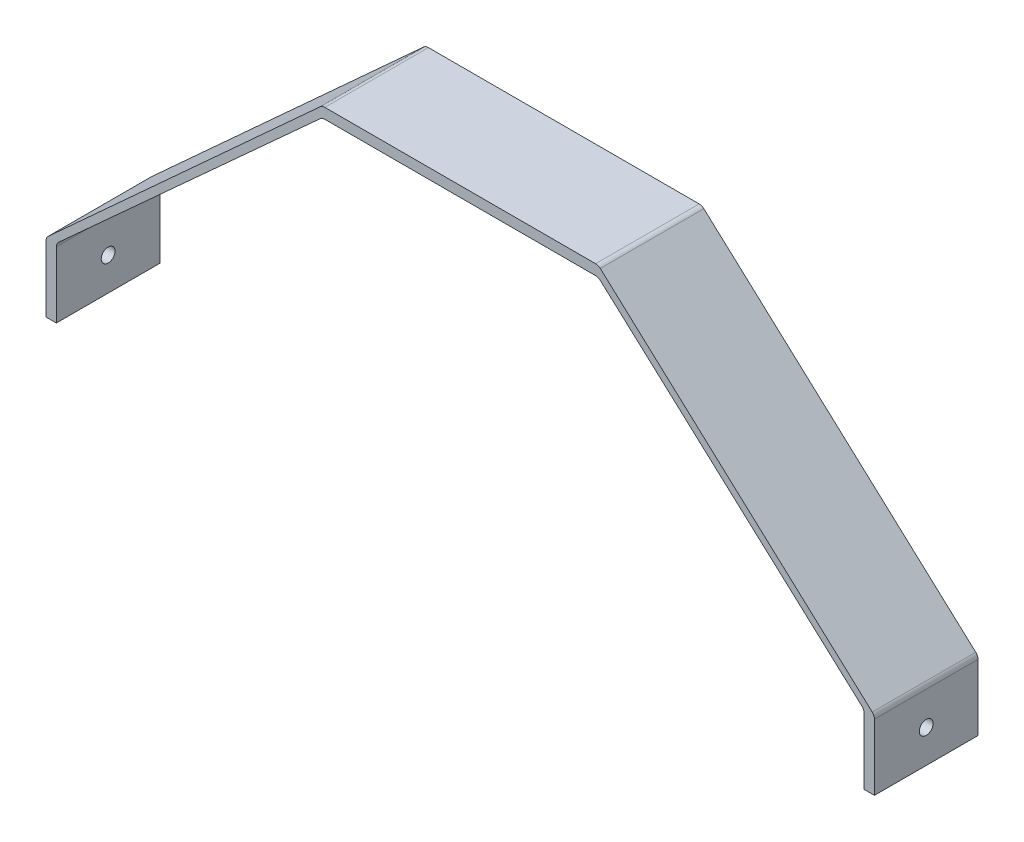
from build123d import *

# Parameters (mm, degrees)
BOSS_EXTRUDE1_DEPTH = 38.1
FILLET1_R           = 2.54
SKETCH2_R           = 2.54
CUT_EXTRUDE1_DEPTH  = 329.417801017


with BuildPart() as part:
    # Sketch1 → Boss-Extrude1 (new body)
    with BuildSketch(Plane.XY):
        Polygon((-50.8, -1.905), (50.8, -1.905), (148.59, -90.805), (148.59, -116.205), (152.4, -116.205), (152.4, -90.805), (50.8, 1.905), (-50.8, 1.905), (-152.4, -90.805), (-152.4, -116.205), (-148.59, -116.205), (-148.59, -90.805), align=None)
    extrude(amount=-BOSS_EXTRUDE1_DEPTH)

    # Fillet1
    fillet1_edges = [part.edges().sort_by_distance(p)[0] for p in [
        (152.4, -90.805, -19.05),
        (148.59, -90.805, -19.05),
        (50.8, -1.905, -19.05),
        (-50.8, -1.905, -19.05),
        (-148.59, -90.805, -19.05),
        (-152.4, -90.805, -19.05),
        (-50.8, 1.905, -19.05),
        (50.8, 1.905, -19.05),
    ]]
    fillet(fillet1_edges, radius=FILLET1_R)

    # Sketch2 → Cut-Extrude1 (cut, through all)
    with BuildSketch(Plane(origin=(152.4, 0, 0), x_dir=(0, 0, -1), z_dir=(1, 0, 0))):
        with Locations((19.05, -104.065395562)):
            Circle(SKETCH2_R)
    extrude(amount=-CUT_EXTRUDE1_DEPTH, mode=Mode.SUBTRACT)


solid = part.part
